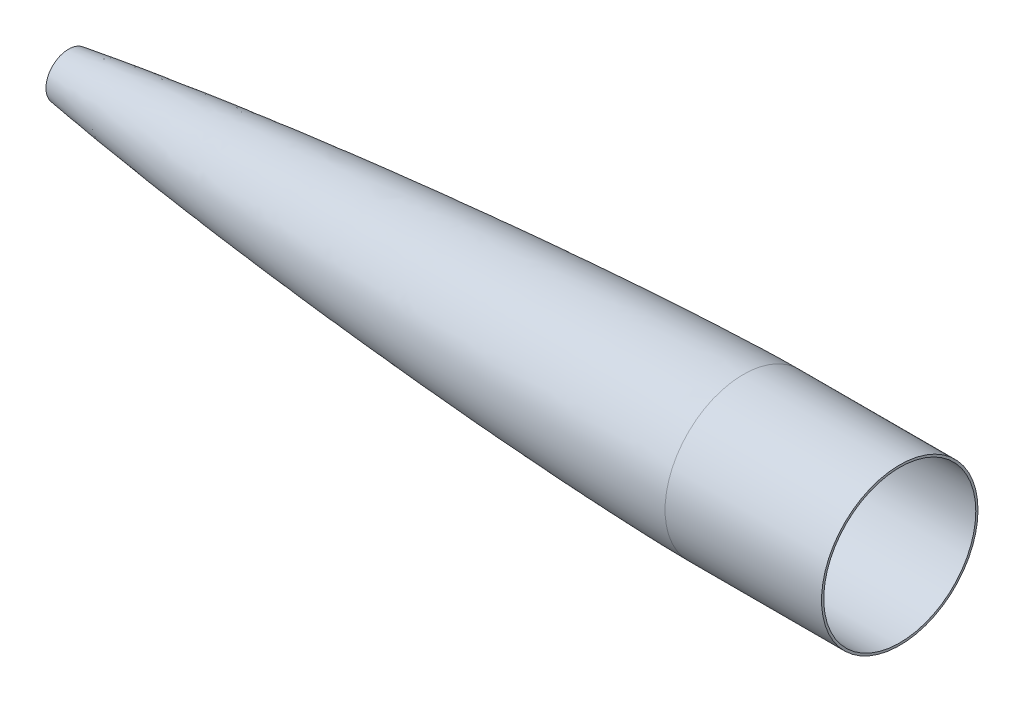
from build123d import *


with BuildPart() as part:
    # Sketch1 → Revolve2 (revolve)
    with BuildSketch(Plane.XY):
        with BuildLine():
            Line((762, 76.2), (914.4, 76.2))
            Line((914.4, 76.2), (914.4, 74.041))
            Line((914.4, 74.041), (762.005368019, 74.041006673))
            add(Edge.make_bspline(
                [(5.00023909, 0), (5.056763051, 0.020141974), (5.169987185, 0.060277444), (5.720324071, 0.253376397), (7.138112705, 0.730448768), (9.459308324, 1.446540501), (13.249114278, 2.524566188), (18.038915558, 3.76569876), (23.830664963, 5.147713239), (29.648590527, 6.448631761), (37.433001111, 8.099324249), (47.197701176, 10.037949097), (58.951435022, 12.217078413), (70.730449997, 14.28383502), (82.528146527, 16.257178768), (98.279214295, 18.782092475), (117.999005521, 21.769617887), (141.697548841, 25.141365429), (165.423748421, 28.334223815), (197.088096381, 32.386455789), (236.714011752, 37.114345659), (284.319409266, 42.340360112), (331.968071588, 47.174260265), (379.652942457, 51.649275221), (427.368996672, 55.785475512), (491.027341303, 60.858576557), (554.735623652, 65.273338991), (618.486238068, 68.955935795), (658.346812289, 70.91231792), (690.2433438, 72.226489321), (714.169922879, 73.06463022), (734.107419195, 73.617553448), (750.061548457, 73.926716535), (758.022543604, 74.031103968), (762.005368019, 74.041006673)],
                knots=[0.006214731, 0.006214731, 0.006214731, 0.006214731, 0.006458683, 0.006702635, 0.00857878, 0.012482013, 0.016385246, 0.024191712, 0.031998179, 0.039804645, 0.047611111, 0.063224044, 0.078836976, 0.094449909, 0.110062842, 0.125675774, 0.156901639, 0.188127505, 0.21935337, 0.250579235, 0.313030965, 0.375482696, 0.437934426, 0.500386157, 0.562837887, 0.625289617, 0.750193078, 0.812644809, 0.875096539, 0.906322404, 0.93754827, 0.968774135, 0.984387067, 1, 1, 1, 1], degree=3))
            Line((5.00023909, 0), (0, 0))
            add(Edge.make_bspline(
                [(0, 0), (0.002703951, 0.007475403), (0.009254403, 0.021798459), (0.027288479, 0.047775191), (0.069513958, 0.094839775), (0.133531264, 0.153441603), (0.220279688, 0.221830422), (0.343572962, 0.308976357), (0.491685509, 0.403755039), (0.665535864, 0.506037908), (0.865193662, 0.61531703), (1.155856981, 0.765404136), (1.606848381, 0.981571373), (2.372411545, 1.316860634), (3.741827992, 1.855855352), (6.209256824, 2.71726793), (10.743822353, 4.102575756), (19.254961482, 6.352033316), (34.107222126, 9.718348949), (59.341159701, 14.638405661), (93.988000037, 20.44281783), (135.983522598, 26.644657651), (182.686162168, 32.823354873), (229.455566621, 38.46902263), (276.276229385, 43.671655421), (323.1379085, 48.48890289), (370.034377396, 52.954610023), (416.961053132, 57.090066024), (463.914878093, 60.905027701), (510.893551419, 64.400662315), (557.895516644, 67.568315917), (604.919686877, 70.388268899), (646.08473916, 72.519362114), (681.382453133, 74.064904962), (709.846968802, 75.089068086), (729.008940191, 75.64934739), (744.750963657, 76.000923697), (754.60721463, 76.147202521), (759.535680712, 76.193872834), (762, 76.2)],
                knots=[0, 0, 0, 0, 0, 4.1103e-05, 8.2207e-05, 0.000164413, 0.000328826, 0.000493239, 0.000657652, 0.000951494, 0.001245335, 0.001544792, 0.001844249, 0.002657057, 0.00385252, 0.005901677, 0.009515863, 0.016280764, 0.028569004, 0.051793804, 0.088907366, 0.150314205, 0.211721038, 0.273127872, 0.334534706, 0.395941541, 0.457348376, 0.518755211, 0.580162046, 0.641568881, 0.702975716, 0.764382551, 0.825789386, 0.887196222, 0.917899639, 0.948603057, 0.974301528, 0.987150764, 1, 1, 1, 1, 1], degree=4))
        make_face()
    revolve(axis=Axis((960.221076641, 0, 0), (-1, 0, 0)))

    # Split1
    split(bisect_by=Plane(origin=(104.775, 0, 0), x_dir=(0, 0, 1), z_dir=(1, 0, 0)), keep=Keep.TOP)


solid = part.part
